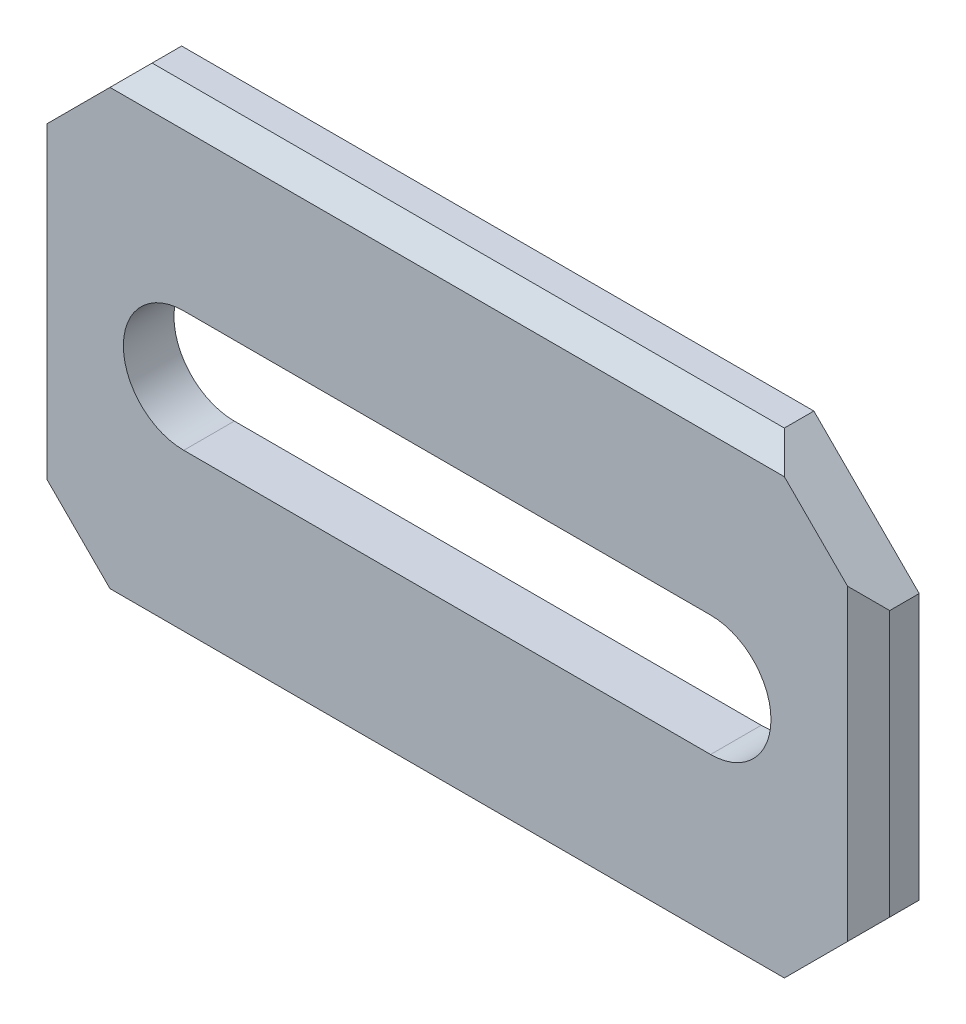
from build123d import *

# Parameters (mm, degrees)
SKETCH_1_W      = 40
SKETCH_1_H      = 22.6
EXTRUDE_1_DEPTH = 1.2
CHAMFER_1_SIZE  = 5
CHAMFER_2_SIZE  = 1


with BuildPart() as part:
    # 스케치1 → 보스-돌출1 (new, symmetric)
    with BuildSketch(Plane.XY):
        Rectangle(SKETCH_1_W, SKETCH_1_H)
        with BuildLine():
            Line((-12.5, 2.864624259), (12.5, 2.864624259))
            ThreePointArc((12.5, 2.864624259), (15.364624259, 0), (12.5, -2.864624259))
            Line((12.5, -2.864624259), (-12.5, -2.864624259))
            ThreePointArc((-12.5, -2.864624259), (-15.364624259, 0), (-12.5, 2.864624259))
        make_face(mode=Mode.SUBTRACT)
    extrude(amount=EXTRUDE_1_DEPTH, both=True)

    # 모따기1
    chamfer_1_edges = [part.edges().sort_by_distance(p)[0] for p in [
        (20, -11.3, 0),
        (-20, -11.3, 0),
        (-20, 11.3, 0),
        (20, 11.3, 0),
    ]]
    chamfer(chamfer_1_edges, length=CHAMFER_1_SIZE)

    # 모따기2
    chamfer_2_edges = [part.edges().sort_by_distance(p)[0] for p in [
        (0, 11.3, 1.2),
        (20, 0, 1.2),
        (-20, 0, 1.2),
        (0, -11.3, 1.2),
    ]]
    chamfer(chamfer_2_edges, length=CHAMFER_2_SIZE)


solid = part.part
